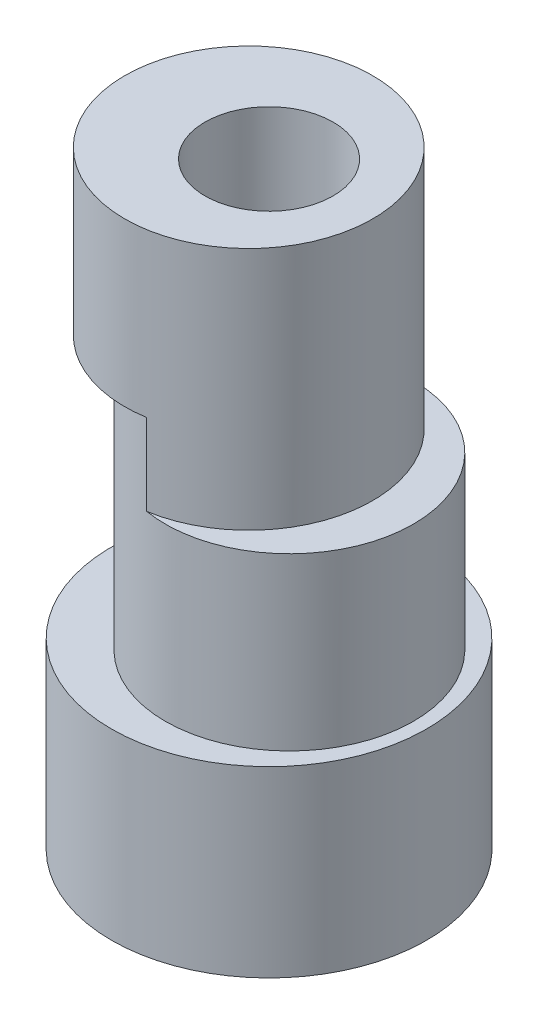
from build123d import *

# Parameters (mm, degrees)
SKETCH1_R           = 7.75
BOSS_EXTRUDE1_DEPTH = 9
SKETCH2_R           = 6.1
BOSS_EXTRUDE2_DEPTH = 12.4
SKETCH4_R           = 6.1
BOSS_EXTRUDE4_DEPTH = 8
SKETCH5_R           = 3.15
CUT_EXTRUDE1_DEPTH  = 32.376503948
SKETCH8_R           = 1.5
CUT_EXTRUDE3_DEPTH  = 32.376503948
SKETCH10_R          = 1.5
CUT_EXTRUDE4_DEPTH  = 5.5
CUT_EXTRUDE5_START  = -4
CUT_EXTRUDE5_DEPTH  = 4


with BuildPart() as part:
    # Sketch1 → Boss-Extrude1 (new body)
    with BuildSketch(Plane(origin=(0, 0, 0), x_dir=(1, 0, 0), z_dir=(0, 1, 0))):
        with Locations(Location((0, 0, 0), (0, 0, 270))):
            Circle(SKETCH1_R)
    extrude(amount=BOSS_EXTRUDE1_DEPTH)

    # Sketch2 → Boss-Extrude2 (add)
    with BuildSketch(Plane(origin=(0, 9, 0), x_dir=(1, 0, 0), z_dir=(0, 1, 0))):
        with Locations(Location((1, 0, 0), (0, 0, 90))):
            Circle(SKETCH2_R)
    extrude(amount=BOSS_EXTRUDE2_DEPTH)

    # Sketch4 → Boss-Extrude4 (add)
    with BuildSketch(Plane(origin=(0, 21.4, 0), x_dir=(1, 0, 0), z_dir=(0, 1, 0))):
        with Locations(Location((-1, 0, 0), (0, 0, 80.564661277))):
            Circle(SKETCH4_R)
    extrude(amount=BOSS_EXTRUDE4_DEPTH)

    # Sketch5 → Cut-Extrude1 (cut, through all)
    with BuildSketch(Plane.XZ):
        with Locations(Location((0, 0, 0), (0, 0, 270))):
            Circle(SKETCH5_R)
    extrude(amount=-CUT_EXTRUDE1_DEPTH, mode=Mode.SUBTRACT)

    # Sketch8 → Cut-Extrude3 (cut, through all)
    with BuildSketch(Plane(origin=(0, 0, 0), x_dir=(0, 0, -1), z_dir=(1, 0, 0))):
        with Locations((0, 5.5)):
            Circle(SKETCH8_R)
    extrude(amount=-CUT_EXTRUDE3_DEPTH, mode=Mode.SUBTRACT)

    # Sketch10 → Cut-Extrude4 (cut)
    with BuildSketch(Plane(origin=(0, 0, 0), x_dir=(0, 0, -1), z_dir=(1, 0, 0))):
        Polygon((0, 8.675426481), (-2.75, 7.08771324), (-2.75, 3.91228676), (0, 2.324573519), (2.75, 3.91228676), (2.75, 7.08771324), align=None)
        with Locations((0, 5.5)):
            Circle(SKETCH10_R, mode=Mode.SUBTRACT)
    extrude(amount=-CUT_EXTRUDE4_DEPTH, mode=Mode.SUBTRACT)

    # Sketch11 → Cut-Extrude5 (cut)
    with BuildSketch(Plane(origin=(0, 21.4, 0), x_dir=(1, 0, 0), z_dir=(0, 1, 0)).offset(CUT_EXTRUDE5_START)):
        with BuildLine():
            ThreePointArc((0, -6.017474553), (5.1, 0), (0, 6.017474553))
            ThreePointArc((0, 6.017474553), (7.1, 0), (0, -6.017474553))
        make_face()
    extrude(amount=CUT_EXTRUDE5_DEPTH, mode=Mode.SUBTRACT)


solid = part.part
